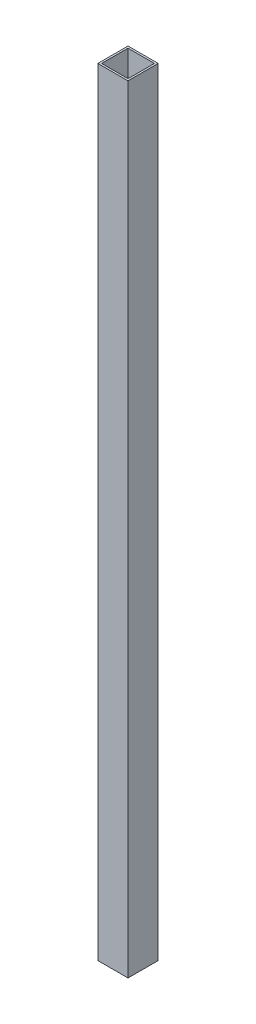
from build123d import *

# Parameters (mm, degrees)
SKETCH1_W           = 25.4
SKETCH1_H           = 25.4
SKETCH1_W_2         = 22.225
SKETCH1_H_2         = 22.225
BOSS_EXTRUDE1_DEPTH = 654.05


with BuildPart() as part:
    # Sketch1 → Boss-Extrude1 (new body)
    with BuildSketch(Plane(origin=(0, 0, 0), x_dir=(1, 0, 0), z_dir=(0, 1, 0))):
        Rectangle(SKETCH1_W, SKETCH1_H)
        Rectangle(SKETCH1_W_2, SKETCH1_H_2, mode=Mode.SUBTRACT)
    extrude(amount=BOSS_EXTRUDE1_DEPTH)


solid = part.part
